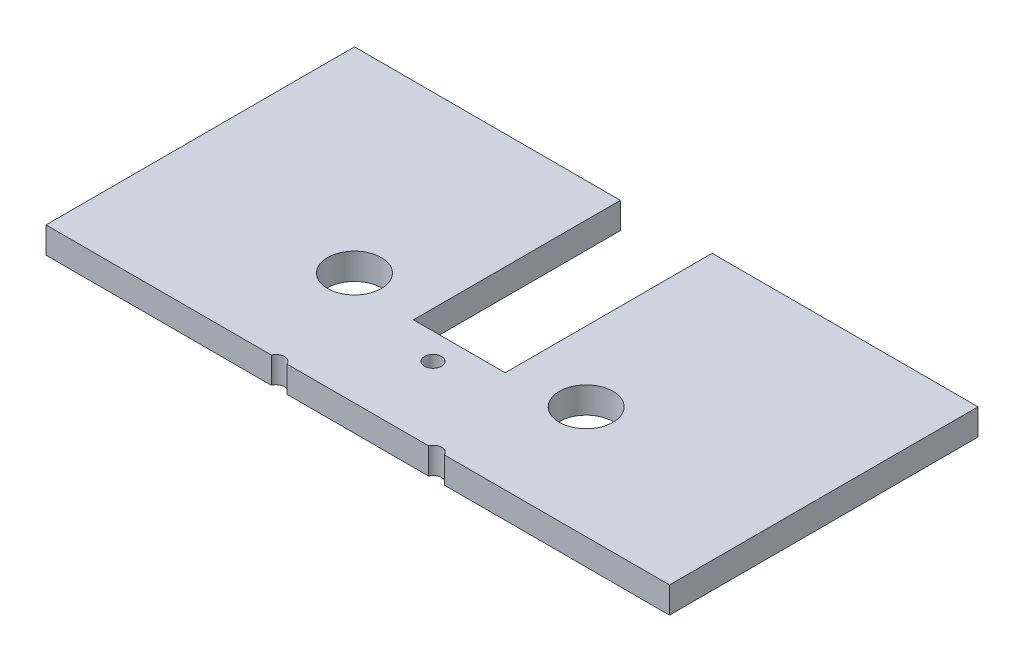
from build123d import *

# Parameters (mm, degrees)
SKETCH1_R           = 2.05
BOSS_EXTRUDE1_DEPTH = 2
SKETCH3_R           = 0.65
CUT_EXTRUDE1_DEPTH  = 16.490262281
SKETCH4_R           = 0.65
CUT_EXTRUDE2_DEPTH  = 16.490262281
BOSS_EXTRUDE2_DEPTH = 2


with BuildPart() as part:
    # Sketch1 → Boss-Extrude1 (new body)
    with BuildSketch(Plane(origin=(0, 0, 0), x_dir=(1, 0, 0), z_dir=(0, 1, 0))):
        Polygon((-3.5, 6.76929), (-3.5, 0.98071), (3.5, 0.98071), (3.5, 6.76929), (13.78858, 6.76929), (13.78858, -6.76929), (-13.78858, -6.76929), (-13.78858, 6.76929), align=None)
        with Locations(Location((-8.84, 1.81955, 0), (0, 0, 270))):
            Circle(SKETCH1_R, mode=Mode.SUBTRACT)
        with Locations(Location((8.84, 1.81955, 0), (0, 0, 270))):
            Circle(SKETCH1_R, mode=Mode.SUBTRACT)
    extrude(amount=BOSS_EXTRUDE1_DEPTH)

    # Sketch3 → Cut-Extrude1 (cut, through all)
    with BuildSketch(Plane(origin=(0, 2, 0), x_dir=(1, 0, 0), z_dir=(0, 1, 0))):
        with Locations(Location((-0.00858, -1.01929, 0), (0, 0, 270))):
            Circle(SKETCH3_R)
    extrude(amount=-CUT_EXTRUDE1_DEPTH, mode=Mode.SUBTRACT)

    # Sketch4 → Cut-Extrude2 (cut, through all)
    with BuildSketch(Plane(origin=(0, 2, 0), x_dir=(1, 0, 0), z_dir=(0, 1, 0))):
        with Locations((6, -7.01929)):
            Circle(SKETCH4_R)
        with Locations((-6, -7.01929)):
            Circle(SKETCH4_R)
    extrude(amount=-CUT_EXTRUDE2_DEPTH, mode=Mode.SUBTRACT)

    # Sketch5 → Boss-Extrude2 (add)
    with BuildSketch(Plane(origin=(0, 2, 0), x_dir=(1, 0, 0), z_dir=(0, 1, 0))):
        Polygon((-13.78858, -6.76929), (-23.78858, -6.76929), (-23.78858, 16.76929), (-3.5, 16.76929), (-3.5, 6.76929), (-13.78858, 6.76929), align=None)
        Polygon((3.5, 6.76929), (3.5, 16.76929), (23.78858, 16.76929), (23.78858, -6.76929), (13.78858, -6.76929), (13.78858, 6.76929), align=None)
    extrude(amount=-BOSS_EXTRUDE2_DEPTH)


solid = part.part
